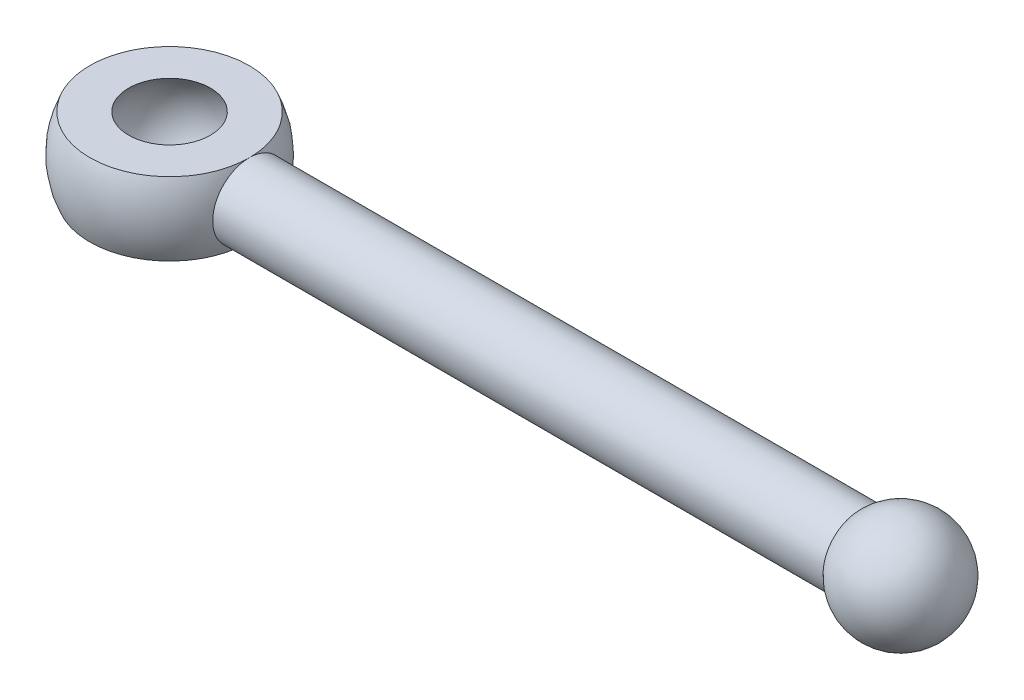
from build123d import *

# Parameters (mm, degrees)
SKETCH_3_W          = 80
SKETCH_3_H          = 20
CUT_EXTRUDE_2_DEPTH = 69


with BuildPart() as part:
    # 草图2 → 旋转1 (revolve)
    with BuildSketch(Plane.XY):
        with BuildLine():
            Line((0, 10), (88.819660113, 10))
            ThreePointArc((88.819660113, 10), (105.352331347, 14.012585384), (115, 0))
            Line((115, 0), (-85, 0))
            ThreePointArc((-85, 0), (-100, 15), (-115, 0))
            Line((-115, 0), (-124, 0))
            ThreePointArc((-124, 0), (-105.117705467, 23.448008247), (-78.182575771, 10))
            Line((-78.182575771, 10), (0, 10))
        make_face()
    revolve(axis=Axis((0, 0, 0), (1, 0, 0)))

    # 草图3 → 切除-拉伸2 (cut, symmetric)
    with BuildSketch(Plane.XY):
        with Locations((-100, 20)):
            Rectangle(SKETCH_3_W, SKETCH_3_H)
        with Locations((-100, -20)):
            Rectangle(SKETCH_3_W, SKETCH_3_H)
    extrude(amount=CUT_EXTRUDE_2_DEPTH, both=True, mode=Mode.SUBTRACT)


solid = part.part
